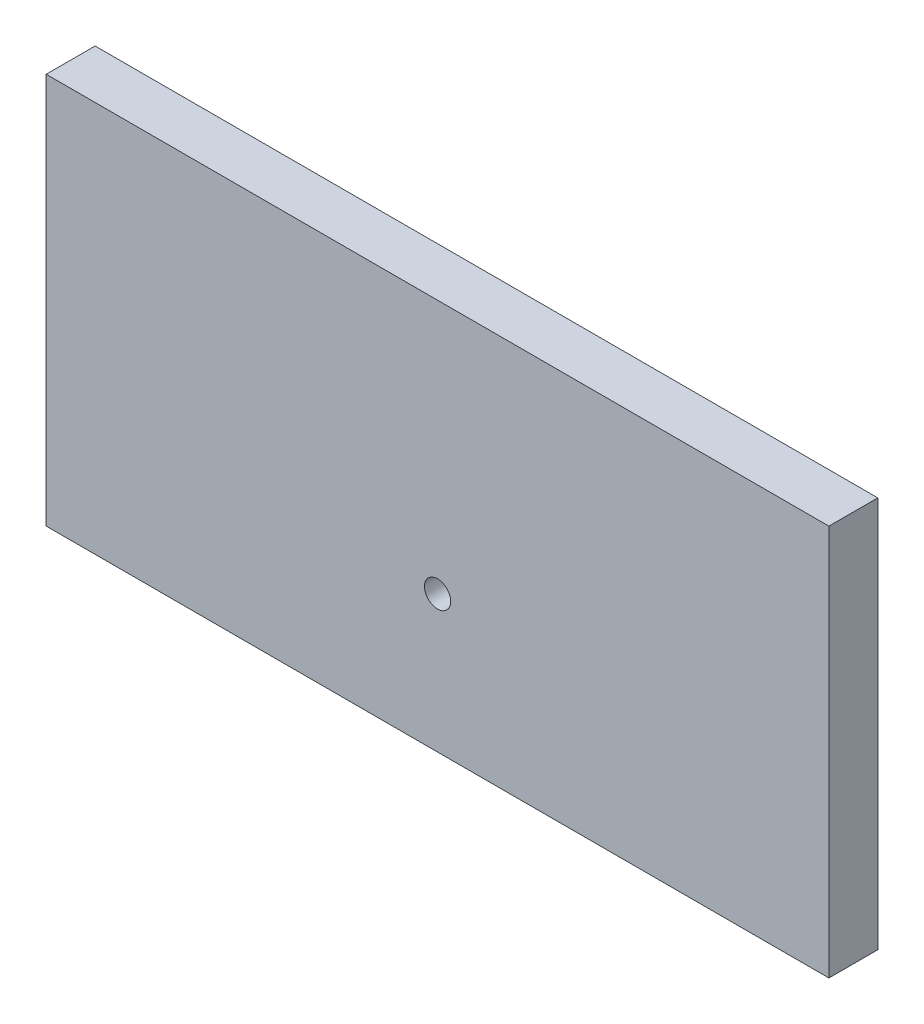
from build123d import *

# Parameters (mm, degrees)
SKETCH2_W            = 101.6
SKETCH2_H            = 6.35
BOSS_EXTRUDE1_DEPTH  = 50.8
M3_CLEARANCE_HOLE1_D = 3.4


with BuildPart() as part:
    # Sketch2 → Boss-Extrude1 (new body)
    with BuildSketch(Plane(origin=(0, 0, 0), x_dir=(1, 0, 0), z_dir=(0, 1, 0))):
        with Locations((50.8, 3.175)):
            Rectangle(SKETCH2_W, SKETCH2_H)
    extrude(amount=BOSS_EXTRUDE1_DEPTH)

    # M3 Clearance Hole1 (through all)
    with Locations(Plane.XY):
        with Locations((50.8, 17.78)):
            Hole(M3_CLEARANCE_HOLE1_D / 2)


solid = part.part
